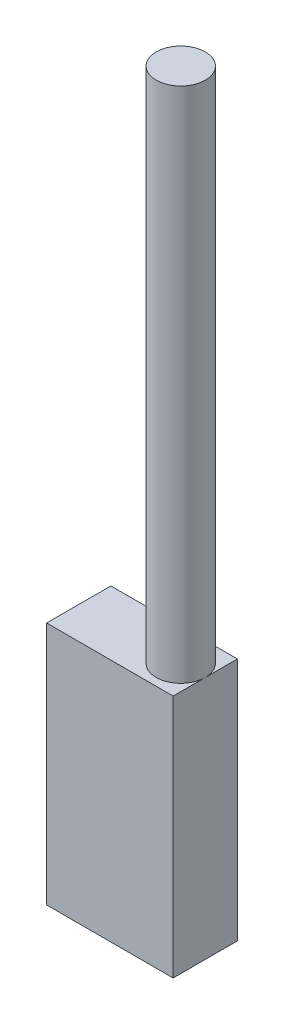
from build123d import *

# Parameters (mm, degrees)
SKETCH2_W           = 25.8
SKETCH2_H           = 49.8
BOSS_EXTRUDE1_DEPTH = 13.1
SKETCH3_R           = 5
BOSS_EXTRUDE2_DEPTH = 105.5


with BuildPart() as part:
    # Sketch2 → Boss-Extrude1 (new body)
    with BuildSketch(Plane.XY):
        with Locations((12.9, 24.9)):
            Rectangle(SKETCH2_W, SKETCH2_H)
    extrude(amount=BOSS_EXTRUDE1_DEPTH)

    # Sketch3 → Boss-Extrude2 (add)
    with BuildSketch(Plane(origin=(0, 49.8, 0), x_dir=(1, 0, 0), z_dir=(0, 1, 0))):
        with Locations((20.8, -6.55)):
            Circle(SKETCH3_R)
    extrude(amount=BOSS_EXTRUDE2_DEPTH)


solid = part.part
